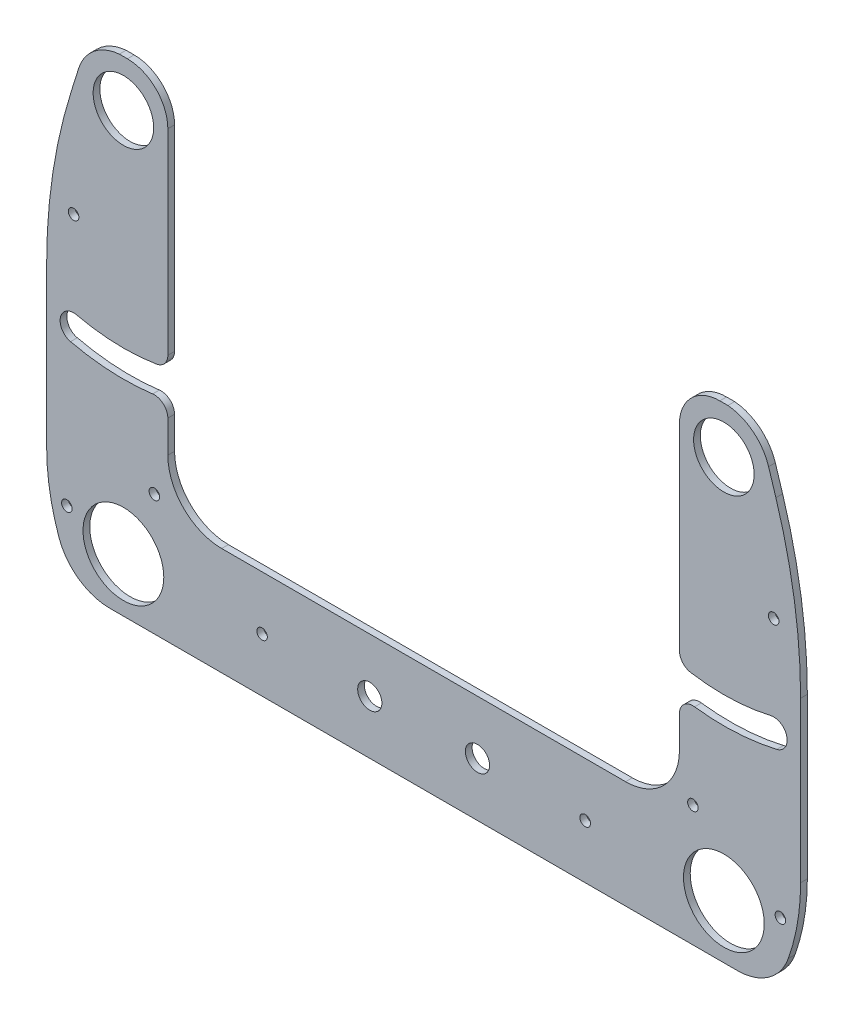
from build123d import *

# Parameters (mm, degrees)
SKETCH1_R           = 14.2875
SKETCH1_R_2         = 19.05
SKETCH1_R_3         = 2.4892
SKETCH1_R_4         = 5.715
BOSS_EXTRUDE3_DEPTH = 3.175
SKETCH2_W           = 355.6
SKETCH2_H           = 19.05
CUT_EXTRUDE1_DEPTH  = 290.621961572
FILLET1_R           = 19.05
CUT_EXTRUDE2_DEPTH  = 290.621961572
FILLET2_R           = 254
CUT_EXTRUDE3_DEPTH  = 290.621961572
FILLET3_R           = 25.4
CUT_EXTRUDE4_DEPTH  = 290.621961572
FILLET4_R           = 6.35


with BuildPart() as part:
    # Sketch1 → Boss-Extrude3 (new body)
    with BuildSketch(Plane.XY):
        with BuildLine():
            Line((120.65, -152.4), (120.65, -6.35))
            Line((120.65, -6.35), (120.65, 6.35))
            ThreePointArc((120.65, 6.35), (124.369743879, 15.330256121), (133.35, 19.05))
            Line((133.35, 19.05), (165.1, 19.05))
            ThreePointArc((165.1, 19.05), (174.080256121, 15.330256121), (177.8, 6.35))
            Line((177.8, 6.35), (177.8, -6.35))
            Line((177.8, -6.35), (177.8, -222.25))
            ThreePointArc((177.8, -222.25), (175.940128061, -226.740128061), (171.45, -228.6))
            Line((171.45, -228.6), (12.7, -228.6))
            Line((12.7, -228.6), (-12.7, -228.6))
            Line((-12.7, -228.6), (-171.45, -228.6))
            ThreePointArc((-171.45, -228.6), (-175.940128061, -226.740128061), (-177.8, -222.25))
            Line((-177.8, -222.25), (-177.8, -6.35))
            Line((-177.8, -6.35), (-177.8, 6.35))
            ThreePointArc((-177.8, 6.35), (-174.080256121, 15.330256121), (-165.1, 19.05))
            Line((-165.1, 19.05), (-133.35, 19.05))
            ThreePointArc((-133.35, 19.05), (-124.369743879, 15.330256121), (-120.65, 6.35))
            Line((-120.65, 6.35), (-120.65, -6.35))
            Line((-120.65, -6.35), (-120.65, -152.4))
            ThreePointArc((-120.65, -152.4), (-113.210512242, -170.360512242), (-95.25, -177.8))
            Line((-95.25, -177.8), (-12.7, -177.8))
            Line((-12.7, -177.8), (12.7, -177.8))
            Line((12.7, -177.8), (95.25, -177.8))
            ThreePointArc((95.25, -177.8), (113.210512242, -170.360512242), (120.65, -152.4))
        make_face()
        with Locations((141.605, -22.02688)):
            Circle(SKETCH1_R, mode=Mode.SUBTRACT)
        with Locations(Location((-141.605, -22.02688, 0), (0, 0, 180))):
            Circle(SKETCH1_R, mode=Mode.SUBTRACT)
        with Locations((-141.605, -203.2)):
            Circle(SKETCH1_R_2, mode=Mode.SUBTRACT)
        with Locations(Location((141.605, -203.2, 0), (0, 0, 180))):
            Circle(SKETCH1_R_2, mode=Mode.SUBTRACT)
        with Locations((-76.2, -203.2)):
            Circle(SKETCH1_R_3, mode=Mode.SUBTRACT)
        with Locations(Location((76.2, -203.2, 0), (0, 0, 180))):
            Circle(SKETCH1_R_3, mode=Mode.SUBTRACT)
        with Locations((-25.4, -203.2)):
            Circle(SKETCH1_R_4, mode=Mode.SUBTRACT)
        with Locations((-149.225, 6.35)):
            Circle(SKETCH1_R_3, mode=Mode.SUBTRACT)
        with Locations(Location((149.225, 6.35, 0), (0, 0, 180))):
            Circle(SKETCH1_R_3, mode=Mode.SUBTRACT)
        with Locations((-168.275, -196.85)):
            Circle(SKETCH1_R_3, mode=Mode.SUBTRACT)
        with Locations(Location((168.275, -196.85, 0), (0, 0, 180))):
            Circle(SKETCH1_R_3, mode=Mode.SUBTRACT)
        with Locations((-165.1, -76.2)):
            Circle(SKETCH1_R_3, mode=Mode.SUBTRACT)
        with Locations(Location((165.1, -76.2, 0), (0, 0, 180))):
            Circle(SKETCH1_R_3, mode=Mode.SUBTRACT)
        with Locations((-127, -171.45)):
            Circle(SKETCH1_R_3, mode=Mode.SUBTRACT)
        with Locations(Location((127, -171.45, 0), (0, 0, 180))):
            Circle(SKETCH1_R_3, mode=Mode.SUBTRACT)
        with Locations(Location((25.4, -203.2, 0), (0, 0, 180))):
            Circle(SKETCH1_R_4, mode=Mode.SUBTRACT)
    extrude(amount=BOSS_EXTRUDE3_DEPTH)

    # Sketch2 → Cut-Extrude1 (cut, through all)
    with BuildSketch(Plane.XY.offset(3.175)):
        with Locations((0, 9.525)):
            Rectangle(SKETCH2_W, SKETCH2_H)
    extrude(amount=-CUT_EXTRUDE1_DEPTH, mode=Mode.SUBTRACT)

    # Fillet1
    fillet1_edges = [part.edges().sort_by_distance(p)[0] for p in [
        (-177.8, 0, 1.5875),
        (120.65, 0, 1.5875),
        (177.8, 0, 1.5875),
        (-120.65, 0, 1.5875),
    ]]
    fillet(fillet1_edges, radius=FILLET1_R)

    # Sketch3 → Cut-Extrude2 (cut, through all)
    with BuildSketch(Plane.XY.offset(3.175)):
        with BuildLine():
            Line((-177.8, 0), (-177.8, -63.5))
            Line((-177.8, -63.5), (-162.698792053, -15.403859213))
            ThreePointArc((-162.698792053, -15.403859213), (-155.445369527, -4.785747819), (-143.51, 0))
            Line((-143.51, 0), (-177.8, 0))
        make_face()
    cut_extrude2 = extrude(amount=-CUT_EXTRUDE2_DEPTH, mode=Mode.SUBTRACT)

    # Mirror1: Cut-Extrude2 across plane
    add(cut_extrude2.mirror(Plane.ZY), mode=Mode.SUBTRACT)

    # Fillet2
    fillet2_edges = [part.edges().sort_by_distance(p)[0] for p in [
        (-177.8, -63.5, 1.5875),
        (177.8, -63.5, 1.5875),
    ]]
    fillet(fillet2_edges, radius=FILLET2_R)

    # Sketch4 → Cut-Extrude3 (cut, through all)
    with BuildSketch(Plane.XY.offset(3.175)):
        with BuildLine():
            Line((-177.8, -177.8), (-177.8, -228.6))
            Line((-177.8, -228.6), (-164.188181024, -228.6))
            ThreePointArc((-164.188181024, -228.6), (-174.338063951, -204.096014982), (-177.8, -177.8))
        make_face()
        with BuildLine():
            Line((177.8, -177.8), (177.8, -228.6))
            Line((177.8, -228.6), (164.188181024, -228.6))
            ThreePointArc((164.188181024, -228.6), (174.338063951, -204.096014982), (177.8, -177.8))
        make_face()
    extrude(amount=-CUT_EXTRUDE3_DEPTH, mode=Mode.SUBTRACT)

    # Fillet3
    fillet3_edges = [part.edges().sort_by_distance(p)[0] for p in [
        (-164.188181024, -228.6, 1.5875),
        (164.188181024, -228.6, 1.5875),
    ]]
    fillet(fillet3_edges, radius=FILLET3_R)

    # Sketch5 → Cut-Extrude4 (cut, through all)
    with BuildSketch(Plane.XY.offset(3.175)):
        with BuildLine():
            Line((-120.65, -129.796193121), (-120.65, -116.826181287))
            ThreePointArc((-120.65, -116.826181287), (-142.167804376, -119.112938735), (-163.657650988, -116.576867488))
            ThreePointArc((-163.657650988, -116.576867488), (-171.284022099, -121.318540575), (-166.542349012, -128.944911687))
            ThreePointArc((-166.542349012, -128.944911687), (-143.641159604, -131.795686724), (-120.65, -129.796193121))
        make_face()
        with BuildLine():
            Line((120.65, -129.796193121), (120.65, -116.826181287))
            ThreePointArc((120.65, -116.826181287), (142.167804376, -119.112938735), (163.657650988, -116.576867488))
            ThreePointArc((163.657650988, -116.576867488), (171.284022099, -121.318540575), (166.542349012, -128.944911687))
            ThreePointArc((166.542349012, -128.944911687), (143.641159604, -131.795686724), (120.65, -129.796193121))
        make_face()
    extrude(amount=-CUT_EXTRUDE4_DEPTH, mode=Mode.SUBTRACT)

    # Fillet4
    fillet4_edges = [part.edges().sort_by_distance(p)[0] for p in [
        (-120.65, -116.826181287, 1.5875),
        (-120.65, -129.796193121, 1.5875),
        (120.65, -129.796193121, 1.5875),
        (120.65, -116.826181287, 1.5875),
    ]]
    fillet(fillet4_edges, radius=FILLET4_R)


solid = part.part
